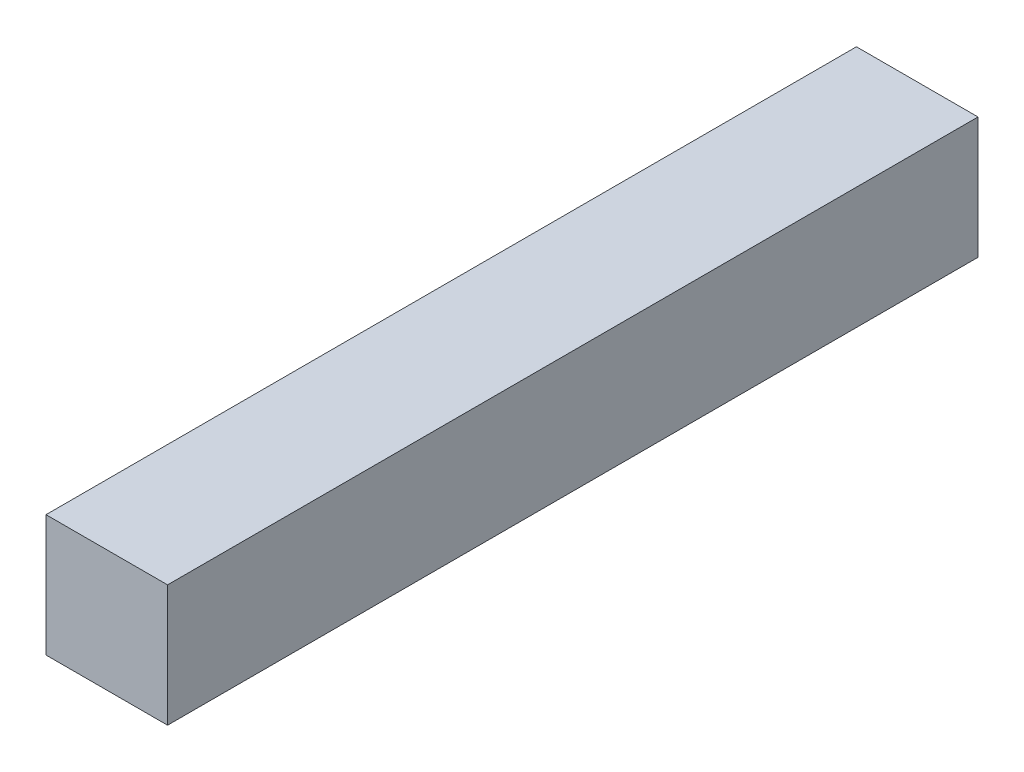
from build123d import *

# Parameters (mm, degrees)
SKETCH1_W           = 7.62
SKETCH1_H           = 7.62
BOSS_EXTRUDE1_DEPTH = 50.8


with BuildPart() as part:
    # Sketch1 → Boss-Extrude1 (new body)
    with BuildSketch(Plane.XY):
        with Locations((-3.81, 3.81)):
            Rectangle(SKETCH1_W, SKETCH1_H)
    extrude(amount=BOSS_EXTRUDE1_DEPTH)


solid = part.part
